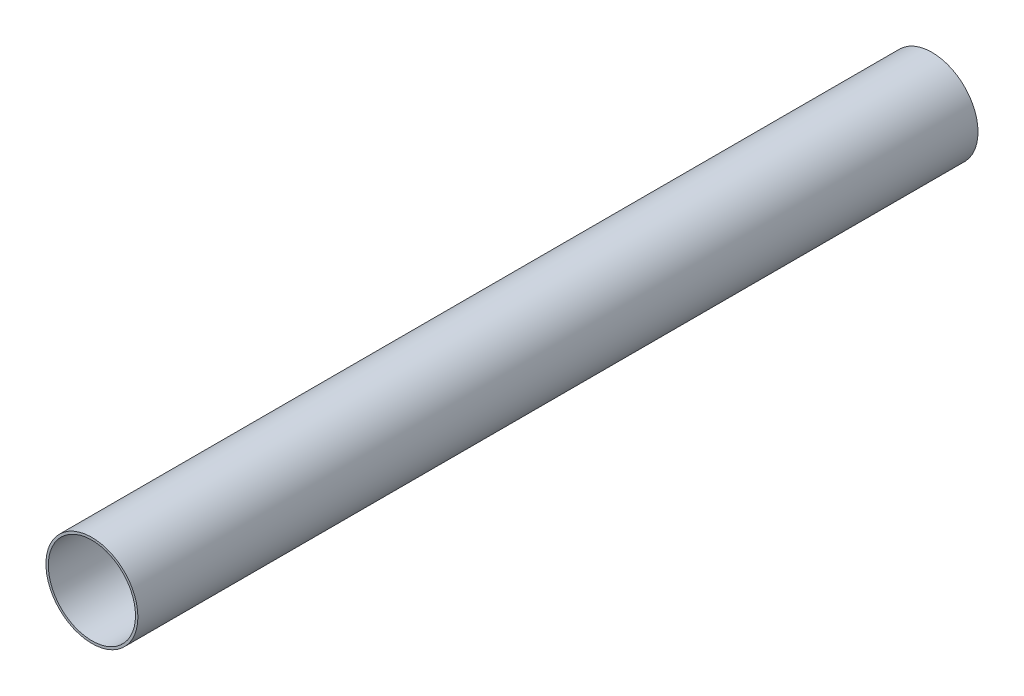
from build123d import *

# Parameters (mm, degrees)
SKETCH1_R           = 15.29375
SKETCH1_R_2         = 14.5
BOSS_EXTRUDE1_DEPTH = 279.4


with BuildPart() as part:
    # Sketch1 → Boss-Extrude1 (new body)
    with BuildSketch(Plane.XY):
        Circle(SKETCH1_R)
        Circle(SKETCH1_R_2, mode=Mode.SUBTRACT)
    extrude(amount=BOSS_EXTRUDE1_DEPTH)


solid = part.part
